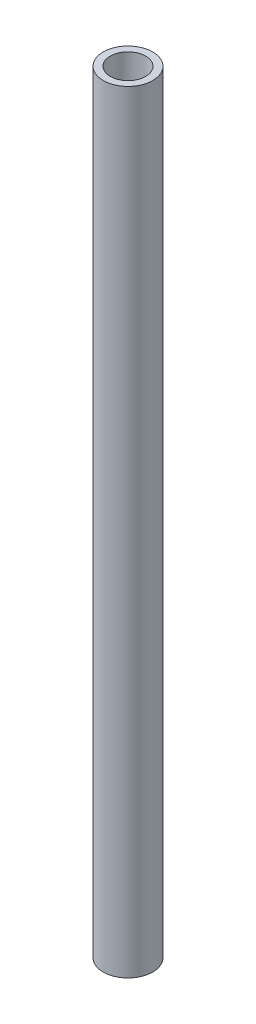
from build123d import *

# Parameters (mm, degrees)
SKETCH1_R           = 1.925
BOSS_EXTRUDE1_DEPTH = 60
SKETCH2_R           = 1.375
CUT_EXTRUDE1_DEPTH  = 11
CUT_EXTRUDE2_START  = -49
SKETCH2_2_R         = 1.375
CUT_EXTRUDE2_DEPTH  = 11


with BuildPart() as part:
    # Sketch1 → Boss-Extrude1 (new body)
    with BuildSketch(Plane(origin=(0, 0, 0), x_dir=(1, 0, 0), z_dir=(0, 1, 0))):
        with Locations(Location((0, 0, 0), (0, 0, 270))):
            Circle(SKETCH1_R)
    extrude(amount=BOSS_EXTRUDE1_DEPTH)

    # Sketch2 → Cut-Extrude1 (cut)
    with BuildSketch(Plane(origin=(0, 60, 0), x_dir=(1, 0, 0), z_dir=(0, 1, 0))):
        with Locations(Location((0, 0, 0), (0, 0, 270))):
            Circle(SKETCH2_R)
    extrude(amount=-CUT_EXTRUDE1_DEPTH, mode=Mode.SUBTRACT)

    # Sketch2<2> → Cut-Extrude2 (cut)
    with BuildSketch(Plane(origin=(0, 60, 0), x_dir=(1, 0, 0), z_dir=(0, 1, 0)).offset(CUT_EXTRUDE2_START)):
        with Locations(Location((0, 0, 0), (0, 0, 270))):
            Circle(SKETCH2_2_R)
    extrude(amount=-CUT_EXTRUDE2_DEPTH, mode=Mode.SUBTRACT)


solid = part.part
